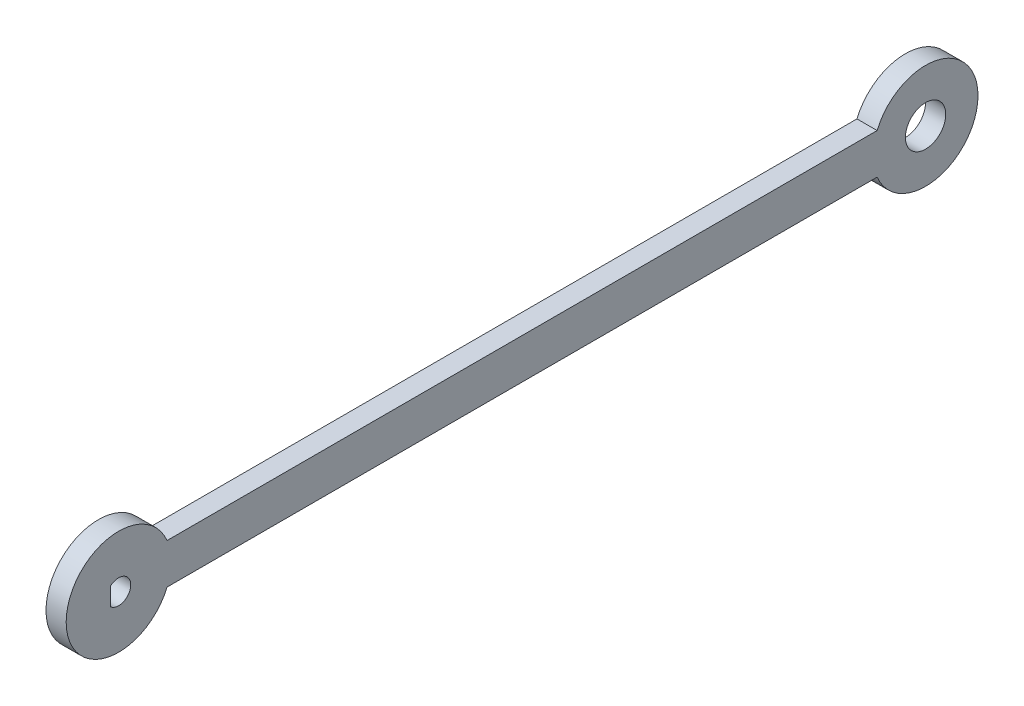
from build123d import *

# Parameters (mm, degrees)
CROQUIS1_R              = 5
SALIENTE_EXTRUIR1_DEPTH = 5


with BuildPart() as part:
    # Croquis1 → Saliente-Extruir1 (new body)
    with BuildSketch(Plane(origin=(0, 0, 0), x_dir=(0, 0, -1), z_dir=(1, 0, 0))):
        with BuildLine():
            Line((188, -5), (12, -5))
            ThreePointArc((12, -5), (-13, 0), (12, 5))
            Line((12, 5), (188, 5))
            ThreePointArc((188, 5), (213, 0), (188, -5))
        make_face()
        with Locations((200, 0)):
            Circle(CROQUIS1_R, mode=Mode.SUBTRACT)
        with BuildLine():
            Line((-2, 0), (-2, 2.236067977))
            ThreePointArc((-2, 2.236067977), (3, 0), (-2, -2.236067977))
            Line((-2, -2.236067977), (-2, 0))
        make_face(mode=Mode.SUBTRACT)
    extrude(amount=SALIENTE_EXTRUIR1_DEPTH)


solid = part.part
